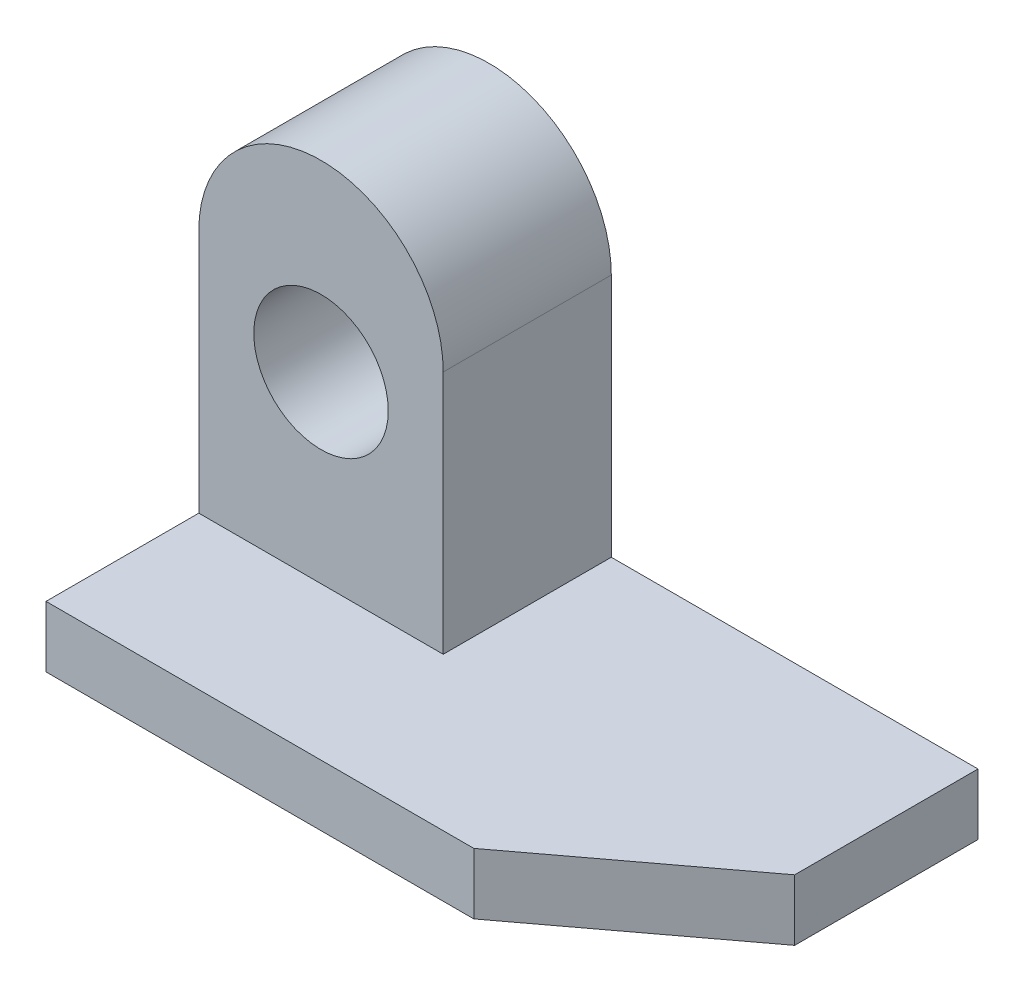
from build123d import *

# Parameters (mm, degrees)
BOSS_EXTRUDE1_DEPTH = 20
SKETCH4_W           = 80
SKETCH4_H           = 55
BOSS_EXTRUDE3_DEPTH = 120
FILLET2_RADIUS      = 40
FILLET2_LENGTH      = 55
SKETCH5_R           = 22
CUT_EXTRUDE1_DEPTH  = 120


with BuildPart() as part:
    # Sketch1 → Boss-Extrude1 (new body)
    with BuildSketch(Plane(origin=(0, 0, 0), x_dir=(1, 0, 0), z_dir=(0, 1, 0))):
        Polygon((-200, 60), (0, 60), (0, 0), (-60, -45), (-200, -45), align=None)
    extrude(amount=BOSS_EXTRUDE1_DEPTH)

    # Sketch4 → Boss-Extrude3 (add)
    with BuildSketch(Plane(origin=(0, 20, 0), x_dir=(1, 0, 0), z_dir=(0, 1, 0))):
        with Locations((-160, 32.5)):
            Rectangle(SKETCH4_W, SKETCH4_H)
    extrude(amount=BOSS_EXTRUDE3_DEPTH)

    # Fillet2: full round fillet: the end face becomes a half cylinder, R = half its width
    fillet2_face = Plane((-160, 140, -32.5), x_dir=(0, 0, 1), z_dir=(0, 1, 0))  # on the end face: x along it, z out of the body
    fillet2_slab = fillet2_face.offset(-FILLET2_RADIUS / 2) * Box(FILLET2_LENGTH, 2 * FILLET2_RADIUS, FILLET2_RADIUS, mode=Mode.PRIVATE)  # the body's end, R deep
    fillet2_round = Plane((-160, 100, -32.5), x_dir=(0, 1, 0), z_dir=(0, 0, 1)) * Cylinder(FILLET2_RADIUS, FILLET2_LENGTH, mode=Mode.PRIVATE)  # its axis R under the face
    add(fillet2_slab - fillet2_round, mode=Mode.SUBTRACT)

    # Sketch5 → Cut-Extrude1 (cut)
    with BuildSketch(Plane.XY.offset(-5)):
        with Locations((-160, 80)):
            Circle(SKETCH5_R)
    extrude(amount=-CUT_EXTRUDE1_DEPTH, mode=Mode.SUBTRACT)


solid = part.part
